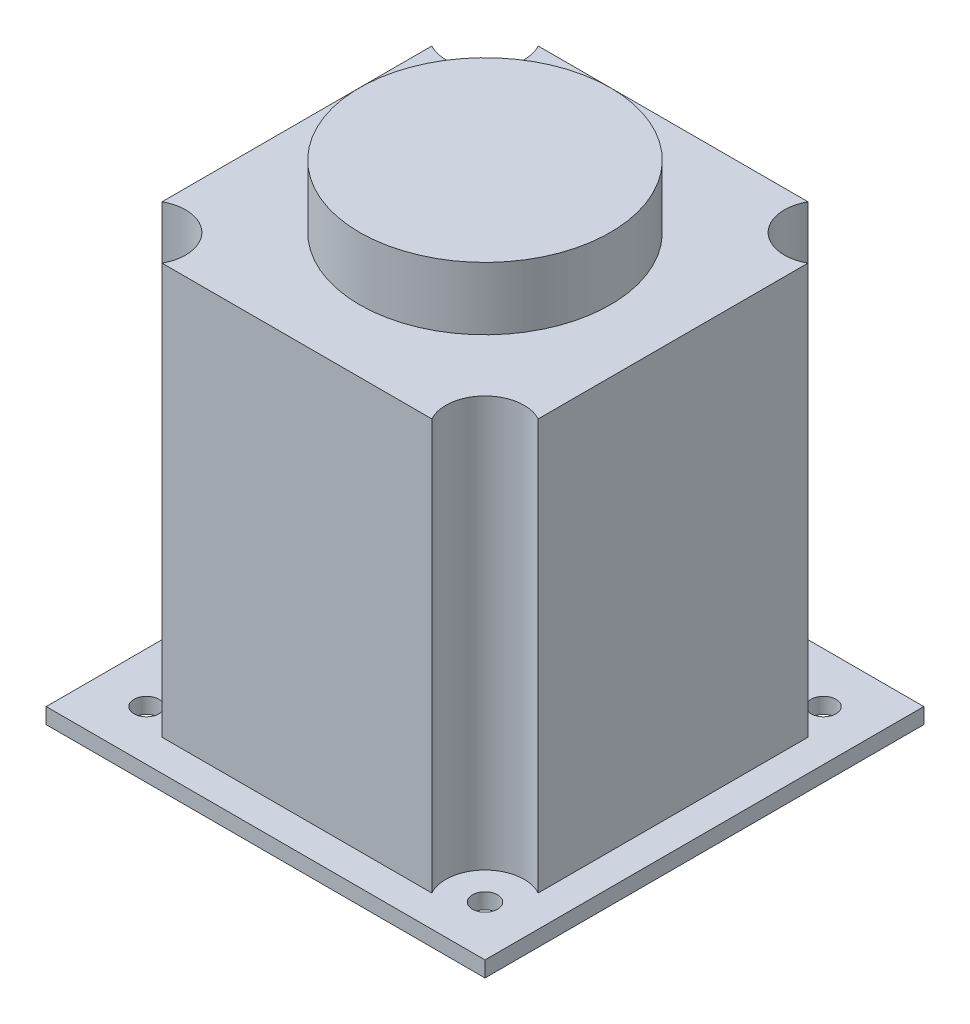
from build123d import *

# Parameters (mm, degrees)
SKETCH_1_W          = 140
SKETCH_1_H          = 140
EXTRUDE_1_DEPTH     = 5
SKETCH_2_R          = 4
CUT_EXTRUDE_1_DEPTH = 5
SKETCH_3_R          = 7.5
EXTRUDE_2_DEPTH     = 16
EXTRUDE_3_DEPTH     = 131
SKETCH_5_R          = 40
EXTRUDE_4_DEPTH     = 20


with BuildPart() as part:
    # 草图1 → 凸台-拉伸1 (new body)
    with BuildSketch(Plane(origin=(0, 0, 0), x_dir=(1, 0, 0), z_dir=(0, 1, 0))):
        Rectangle(SKETCH_1_W, SKETCH_1_H)
    extrude(amount=EXTRUDE_1_DEPTH)

    # 草图2 → 切除-拉伸1 (cut)
    with BuildSketch(Plane(origin=(0, 5, 0), x_dir=(1, 0, 0), z_dir=(0, 1, 0))):
        with Locations(Location((-54, 54, 0), (0, 0, 270))):
            Circle(SKETCH_2_R)
        with Locations(Location((54, 54, 0), (0, 0, 270))):
            Circle(SKETCH_2_R)
        with Locations(Location((54, -54, 0), (0, 0, 270))):
            Circle(SKETCH_2_R)
        with Locations(Location((-54, -54, 0), (0, 0, 270))):
            Circle(SKETCH_2_R)
    extrude(amount=-CUT_EXTRUDE_1_DEPTH, mode=Mode.SUBTRACT)

    # 草图3 → 凸台-拉伸2 (add)
    with BuildSketch(Plane(origin=(0, 5, 0), x_dir=(1, 0, 0), z_dir=(0, 1, 0))):
        with Locations(Location((0, 0, 0), (0, 0, 270))):
            Circle(SKETCH_3_R)
    extrude(amount=-EXTRUDE_2_DEPTH)

    # 草图4 → 凸台-拉伸3 (add)
    with BuildSketch(Plane(origin=(0, 5, 0), x_dir=(1, 0, 0), z_dir=(0, 1, 0))):
        with BuildLine():
            Line((-43.0341439, -60), (43.0341439, -60))
            ThreePointArc((43.0341439, -60), (45.161165235, -45.161165235), (60, -43.0341439))
            Line((60, -43.0341439), (60, 43.0341439))
            ThreePointArc((60, 43.0341439), (45.161165235, 45.161165235), (43.0341439, 60))
            Line((43.0341439, 60), (-43.0341439, 60))
            ThreePointArc((-43.0341439, 60), (-45.161165235, 45.161165235), (-60, 43.0341439))
            Line((-60, 43.0341439), (-60, -43.0341439))
            ThreePointArc((-60, -43.0341439), (-45.161165235, -45.161165235), (-43.0341439, -60))
        make_face()
    extrude(amount=EXTRUDE_3_DEPTH)

    # 草图5 → 凸台-拉伸4 (add)
    with BuildSketch(Plane(origin=(0, 136, 0), x_dir=(1, 0, 0), z_dir=(0, 1, 0))):
        with Locations(Location((0, 0, 0), (0, 0, 270))):
            Circle(SKETCH_5_R)
    extrude(amount=EXTRUDE_4_DEPTH)


solid = part.part
